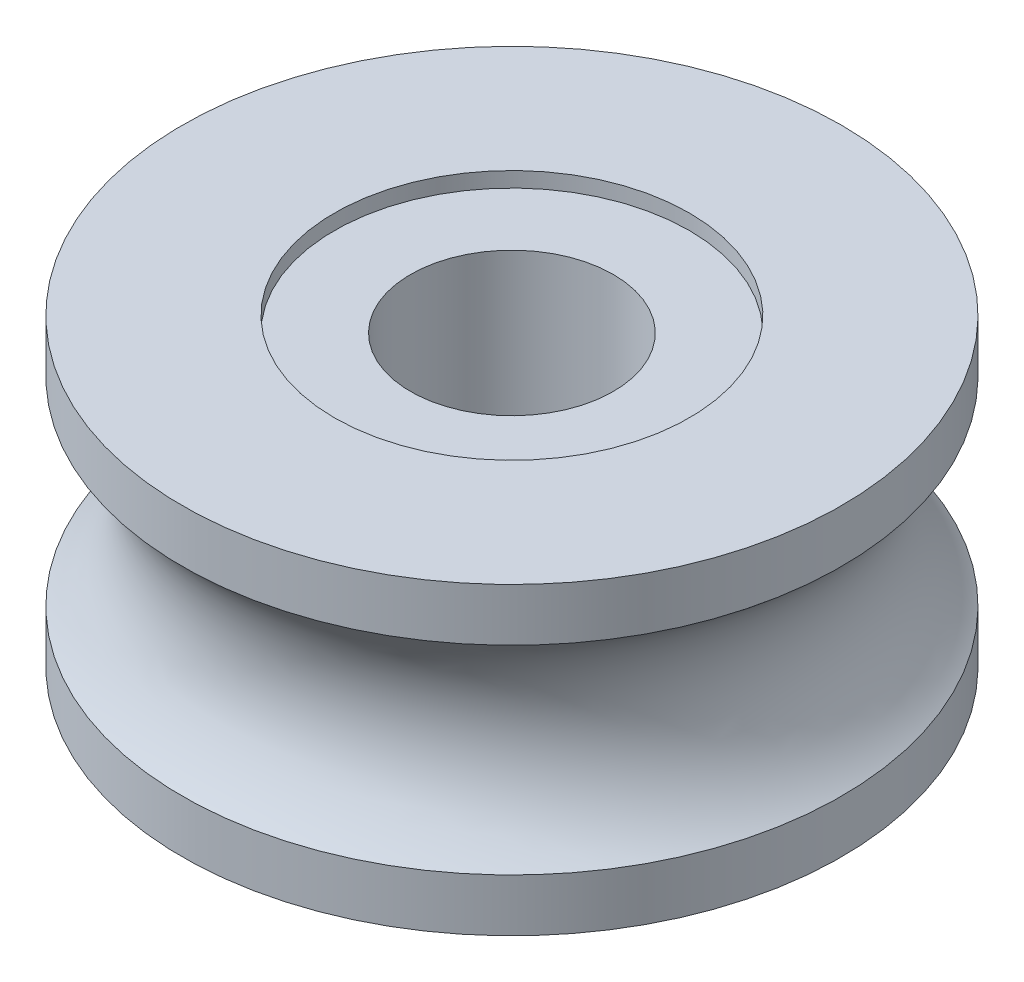
from build123d import *


with BuildPart() as part:
    # Эскиз1 → Повернуть1 (revolve)
    with BuildSketch(Plane.XY, mode=Mode.PRIVATE) as revolve_1_sk:
        with BuildLine():
            Line((2, -3.85), (2, 3.85))
            Line((2, 3.85), (3.5, 3.85))
            Line((3.5, 3.85), (3.5, 4.15))
            Line((3.5, 4.15), (6.5, 4.15))
            Line((6.5, 4.15), (6.5, 3.111504525))
            ThreePointArc((6.5, 3.111504525), (5.55, 1.15), (6.5, -0.811504525))
            Line((6.5, -0.811504525), (6.5, -1.85))
            Line((6.5, -1.85), (3, -1.85))
            Line((3, -1.85), (3, -3.85))
            Line((3, -3.85), (2, -3.85))
        make_face()
    revolve(revolve_1_sk.sketch.rotate(Axis((0, 0, 0), (0, 1, 0)), 90), axis=Axis((0, 0, 0), (0, 1, 0)))


solid = part.part
